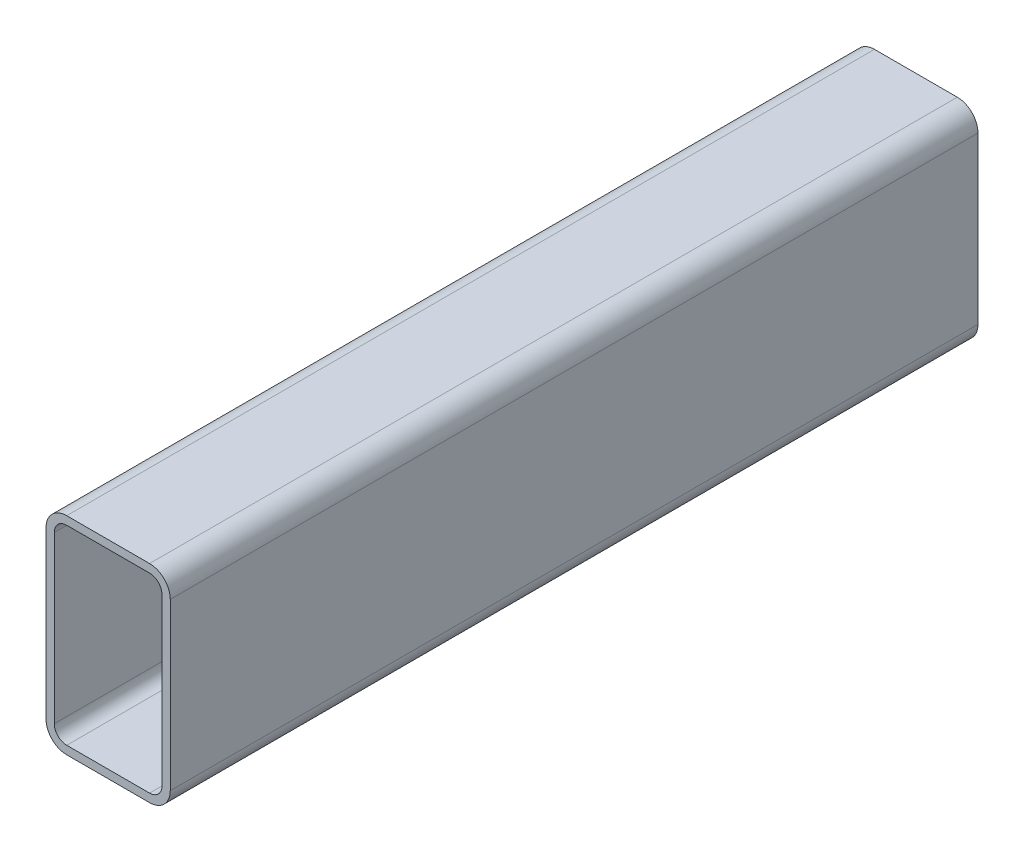
from build123d import *

# Parameters (mm, degrees)
BOSS_EXTRUDE1_DEPTH = 243.75


with BuildPart() as part:
    # Sketch1 → Boss-Extrude1 (new, symmetric)
    with BuildSketch(Plane.XY):
        with BuildLine():
            Line((-37.5, 0), (-37.5, -50))
            ThreePointArc((-37.5, -50), (-33.838834765, -58.838834765), (-25, -62.5))
            Line((-25, -62.5), (0, -62.5))
            Line((0, -62.5), (25, -62.5))
            ThreePointArc((25, -62.5), (33.838834765, -58.838834765), (37.5, -50))
            Line((37.5, -50), (37.5, 0))
            Line((37.5, 0), (37.5, 50))
            ThreePointArc((37.5, 50), (33.838834765, 58.838834765), (25, 62.5))
            Line((25, 62.5), (-25, 62.5))
            ThreePointArc((-25, 62.5), (-33.838834765, 58.838834765), (-37.5, 50))
            Line((-37.5, 50), (-37.5, 0))
        make_face()
        with BuildLine():
            Line((-32.5, 0), (-32.5, -50))
            ThreePointArc((-32.5, -50), (-30.303300859, -55.303300859), (-25, -57.5))
            Line((-25, -57.5), (0, -57.5))
            Line((0, -57.5), (25, -57.5))
            ThreePointArc((25, -57.5), (30.303300859, -55.303300859), (32.5, -50))
            Line((32.5, -50), (32.5, 0))
            Line((32.5, 0), (32.5, 50))
            ThreePointArc((32.5, 50), (30.303300859, 55.303300859), (25, 57.5))
            Line((25, 57.5), (-25, 57.5))
            ThreePointArc((-25, 57.5), (-30.303300859, 55.303300859), (-32.5, 50))
            Line((-32.5, 50), (-32.5, 0))
        make_face(mode=Mode.SUBTRACT)
    extrude(amount=BOSS_EXTRUDE1_DEPTH, both=True)


solid = part.part
